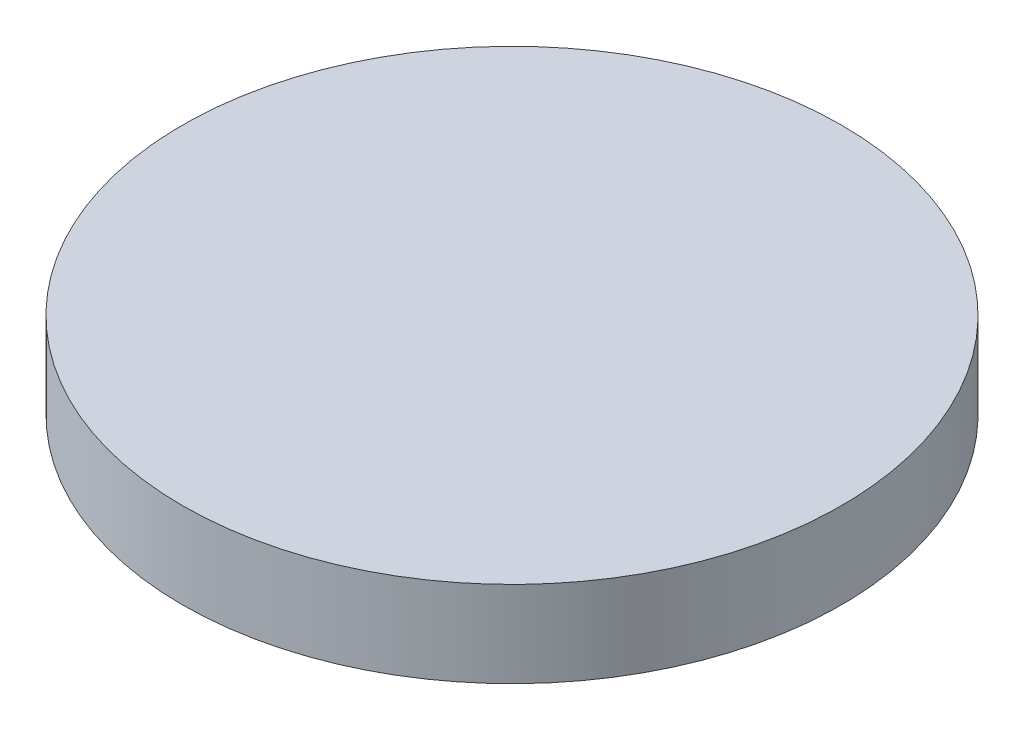
from build123d import *

# Parameters (mm, degrees)
SKETCH1_R           = 11.5
BOSS_EXTRUDE1_DEPTH = 3


with BuildPart() as part:
    # Sketch1 → Boss-Extrude1 (new body)
    with BuildSketch(Plane(origin=(0, 0, 0), x_dir=(1, 0, 0), z_dir=(0, 1, 0))):
        with Locations(Location((0, 0, 0), (0, 0, 270))):
            Circle(SKETCH1_R)
    extrude(amount=BOSS_EXTRUDE1_DEPTH)


solid = part.part
